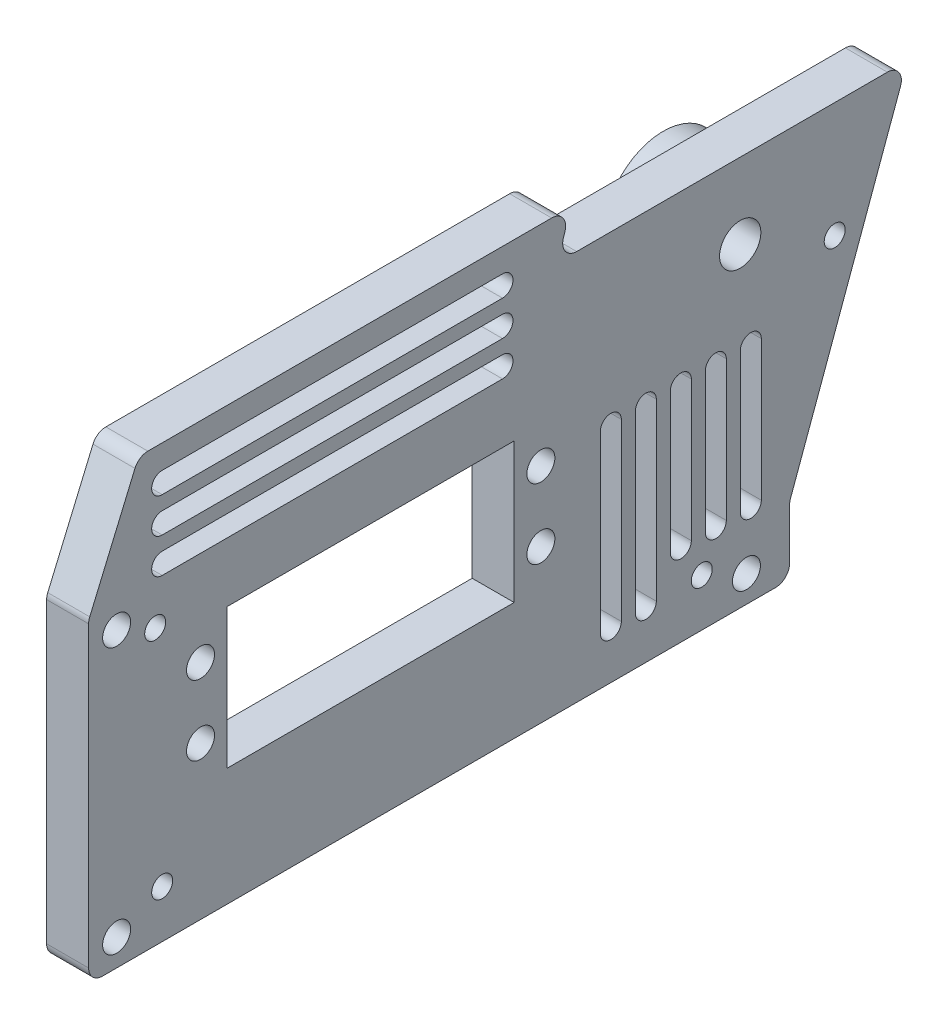
from build123d import *

# Parameters (mm, degrees)
EXTRUDE_1_DEPTH     = 6
SKETCH_2_R          = 2
CUT_EXTRUDE_1_DEPTH = 10
SKETCH_4_R          = 1.5
CUT_EXTRUDE_2_DEPTH = 6
SKETCH_7_R          = 2
SKETCH_7_R_2        = 1.5
CUT_EXTRUDE_3_DEPTH = 6
SKETCH_5_R          = 8.5
EXTRUDE_4_DEPTH     = 11
FILLET_1_R          = 2
SKETCH_8_R          = 7.55
CUT_EXTRUDE_4_DEPTH = 5
SKETCH_9_R          = 2.95
CUT_EXTRUDE_5_DEPTH = 6


with BuildPart() as part:
    # 草图1 → 凸台-拉伸1 (new body)
    with BuildSketch(Plane(origin=(0, 0, 0), x_dir=(0, 0, -1), z_dir=(1, 0, 0))):
        Polygon((-58.108525398, 10), (-58.108525398, -35), (42.059282617, -35), (42.059282617, -30.677521513), (42.059282617, -25.387821403), (52.220185328, 2.502083897), (58.88447221, 20.794388757), (53.88447221, 20.794388757), (8.88447221, 20.794388757), (10.802160114, 26.733589605), (-8.108525398, 26.733589605), (-50.96776046, 26.733589605), align=None)
    extrude(amount=EXTRUDE_1_DEPTH)

    # 草图2 → 切除-拉伸1 (cut)
    with BuildSketch(Plane(origin=(0, 0, 0), x_dir=(0, 0, -1), z_dir=(1, 0, 0))):
        with Locations((6.512667985, -3.171691559)):
            Circle(SKETCH_2_R)
        with Locations((6.512667985, -13.171691559)):
            Circle(SKETCH_2_R)
        with Locations(Location((-42.117332015, -13.171691559, 0), (0, 0, 180))):
            Circle(SKETCH_2_R)
        with Locations(Location((-42.117332015, -3.171691559, 0), (0, 0, 180))):
            Circle(SKETCH_2_R)
        Polygon((-17.802332015, 1.828308441), (-38.302332015, 1.828308441), (-38.302332015, -18.171691559), (-17.802332015, -18.171691559), (2.697667985, -18.171691559), (2.697667985, 1.828308441), align=None)
    extrude(amount=CUT_EXTRUDE_1_DEPTH, mode=Mode.SUBTRACT)

    # 草图4 → 切除-拉伸2 (cut)
    with BuildSketch(Plane(origin=(6, 0, 0), x_dir=(0, 0, -1), z_dir=(1, 0, 0))):
        with Locations((-48.59776046, 4.328308441)):
            Circle(SKETCH_4_R)
        with Locations((48.50223954, 4.328308441)):
            Circle(SKETCH_4_R)
    extrude(amount=-CUT_EXTRUDE_2_DEPTH, mode=Mode.SUBTRACT)

    # 草图7 → 切除-拉伸3 (cut)
    with BuildSketch(Plane(origin=(6, 0, 0), x_dir=(0, 0, -1), z_dir=(1, 0, 0))):
        with Locations((-54.108525398, 6.828308441)):
            Circle(SKETCH_7_R)
        with Locations((35.891474602, -31.171691559)):
            Circle(SKETCH_7_R)
        with Locations((-54.108525398, -31.171691559)):
            Circle(SKETCH_7_R)
        with BuildLine():
            Line((1.03223954, 18.328308441), (-47.59776046, 18.328308441))
            ThreePointArc((-47.59776046, 18.328308441), (-49.09776046, 16.828308441), (-47.59776046, 15.328308441))
            Line((-47.59776046, 15.328308441), (1.03223954, 15.328308441))
            ThreePointArc((1.03223954, 15.328308441), (2.53223954, 16.828308441), (1.03223954, 18.328308441))
        make_face()
        with BuildLine():
            Line((1.03223954, 23.328308441), (-47.59776046, 23.328308441))
            ThreePointArc((-47.59776046, 23.328308441), (-49.09776046, 21.828308441), (-47.59776046, 20.328308441))
            Line((-47.59776046, 20.328308441), (1.03223954, 20.328308441))
            ThreePointArc((1.03223954, 20.328308441), (2.53223954, 21.828308441), (1.03223954, 23.328308441))
        make_face()
        with BuildLine():
            Line((1.03223954, 13.328308441), (-47.59776046, 13.328308441))
            ThreePointArc((-47.59776046, 13.328308441), (-49.09776046, 11.828308441), (-47.59776046, 10.328308441))
            Line((-47.59776046, 10.328308441), (1.03223954, 10.328308441))
            ThreePointArc((1.03223954, 10.328308441), (2.53223954, 11.828308441), (1.03223954, 13.328308441))
        make_face()
        with BuildLine():
            ThreePointArc((18.012667985, -3.171691559), (16.512667985, -1.671691559), (15.012667985, -3.171691559))
            Line((15.012667985, -3.171691559), (15.012667985, -28.171691559))
            ThreePointArc((15.012667985, -28.171691559), (16.512667985, -29.671691559), (18.012667985, -28.171691559))
            Line((18.012667985, -28.171691559), (18.012667985, -3.171691559))
        make_face()
        with BuildLine():
            ThreePointArc((23.012667985, -3.171691559), (21.512667985, -1.671691559), (20.012667985, -3.171691559))
            Line((20.012667985, -3.171691559), (20.012667985, -28.171691559))
            ThreePointArc((20.012667985, -28.171691559), (21.512667985, -29.671691559), (23.012667985, -28.171691559))
            Line((23.012667985, -28.171691559), (23.012667985, -3.171691559))
        make_face()
        with BuildLine():
            ThreePointArc((38.012667985, -3.171691559), (36.512667985, -1.671691559), (35.012667985, -3.171691559))
            Line((35.012667985, -3.171691559), (35.012667985, -23.171691559))
            ThreePointArc((35.012667985, -23.171691559), (36.512667985, -24.671691559), (38.012667985, -23.171691559))
            Line((38.012667985, -23.171691559), (38.012667985, -3.171691559))
        make_face()
        with BuildLine():
            ThreePointArc((28.012667985, -3.171691559), (26.512667985, -1.671691559), (25.012667985, -3.171691559))
            Line((25.012667985, -3.171691559), (25.012667985, -23.171691559))
            ThreePointArc((25.012667985, -23.171691559), (26.512667985, -24.671691559), (28.012667985, -23.171691559))
            Line((28.012667985, -23.171691559), (28.012667985, -3.171691559))
        make_face()
        with BuildLine():
            ThreePointArc((33.012667985, -3.171691559), (31.512667985, -1.671691559), (30.012667985, -3.171691559))
            Line((30.012667985, -3.171691559), (30.012667985, -23.171691559))
            ThreePointArc((30.012667985, -23.171691559), (31.512667985, -24.671691559), (33.012667985, -23.171691559))
            Line((33.012667985, -23.171691559), (33.012667985, -3.171691559))
        make_face()
        with Locations((-47.59776046, -28.171691559)):
            Circle(SKETCH_7_R_2)
        with Locations((29.50223954, -28.171691559)):
            Circle(SKETCH_7_R_2)
    extrude(amount=-CUT_EXTRUDE_3_DEPTH, mode=Mode.SUBTRACT)

    # 草图5 → 凸台-拉伸4 (add)
    with BuildSketch(Plane(origin=(6, 0, 0), x_dir=(0, 0, -1), z_dir=(1, 0, 0))):
        with Locations((35, 10)):
            Circle(SKETCH_5_R)
    extrude(amount=-EXTRUDE_4_DEPTH)

    # 圆角1
    fillet_1_edges = [part.edges().sort_by_distance(p)[0] for p in [
        (3, 10, 58.108525398),
        (3, 26.733589605, 50.96776046),
        (3, 26.733589605, -10.802160114),
        (3, 20.794388757, -8.88447221),
        (3, 20.794388757, -58.88447221),
        (3, -25.387821403, -42.059282617),
        (3, -35, -42.059282617),
        (3, -35, 58.108525398),
    ]]
    fillet(fillet_1_edges, radius=FILLET_1_R)

    # 草图8 → 切除-拉伸4 (cut)
    with BuildSketch(Plane.ZY.offset(5)):
        with Locations((-35, 10)):
            Circle(SKETCH_8_R)
    extrude(amount=-CUT_EXTRUDE_4_DEPTH, mode=Mode.SUBTRACT)

    # 草图9 → 切除-拉伸5 (cut)
    with BuildSketch(Plane.ZY):
        with Locations((-35, 10)):
            Circle(SKETCH_9_R)
    extrude(amount=-CUT_EXTRUDE_5_DEPTH, mode=Mode.SUBTRACT)


solid = part.part
